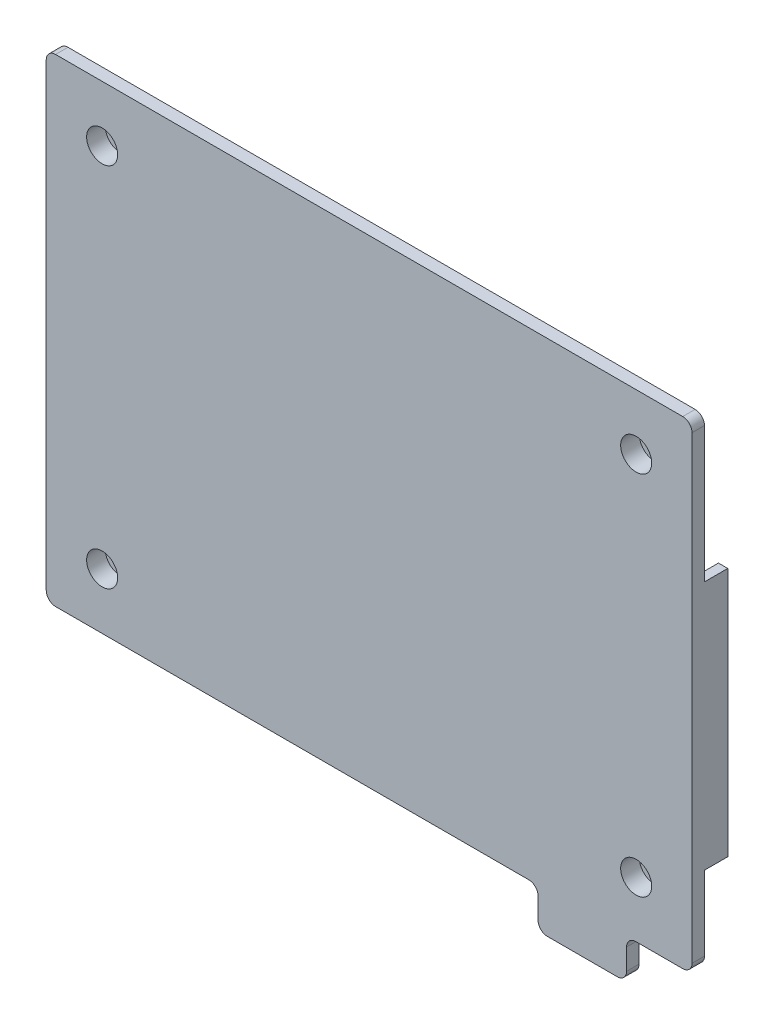
from build123d import *

# Parameters (mm, degrees)
BOTTOM_COVER_DEPTH    = 2
SKETCH5_W             = 1.5
SKETCH5_H             = 40.214188303
CONNECTOR_PANEL_DEPTH = 3.75
SKETCH6_W             = 68
SKETCH6_H             = 60
SKETCH6_W_2           = 64
SKETCH6_H_2           = 56
BATTERY_HOLDER_DEPTH  = 2
FILLET1_R             = 1.5
SKETCH7_R             = 3.5
BOSS_EXTRUDE4_DEPTH   = 3.9125
SKETCH8_R             = 1.25
CUT_EXTRUDE1_DEPTH    = 10
SKETCH9_R             = 2.5
CUT_EXTRUDE2_DEPTH    = 3


with BuildPart() as part:
    # Sketch1 → bottom-cover (new body)
    with BuildSketch(Plane.XY.offset(8.9125)):
        Polygon((102, -2), (102, 75), (-2, 75), (-2, -2), (77.2, -2), (77.2, -8.39995), (91.45, -8.39995), (91.45, -2), align=None)
    extrude(amount=BOTTOM_COVER_DEPTH)

    # Sketch5 → connector-panel (add)
    with BuildSketch(Plane(origin=(0, 0, 8.9125), x_dir=(-1, 0, 0), z_dir=(0, 0, -1))):
        with Locations((-101.25, 31.586987543)):
            Rectangle(SKETCH5_W, SKETCH5_H)
    extrude(amount=CONNECTOR_PANEL_DEPTH)

    # Sketch6 → battery-holder (add)
    with BuildSketch(Plane(origin=(0, 0, 8.9125), x_dir=(-1, 0, 0), z_dir=(0, 0, -1))):
        with Locations((-45.693698314, 36.057827653)):
            Rectangle(SKETCH6_W, SKETCH6_H)
        with Locations((-45.693698314, 36.057827653)):
            Rectangle(SKETCH6_W_2, SKETCH6_H_2, mode=Mode.SUBTRACT)
    extrude(amount=BATTERY_HOLDER_DEPTH)

    # Fillet1
    fillet1_edges = [part.edges().sort_by_distance(p)[0] for p in [
        (102, -2, 9.9125),
        (102, 75, 9.9125),
        (-2, 75, 9.9125),
        (91.45, -8.39995, 9.9125),
        (91.45, -2, 9.9125),
        (77.2, -2, 9.9125),
        (77.2, -8.39995, 9.9125),
        (-2, -2, 9.9125),
    ]]
    fillet(fillet1_edges, radius=FILLET1_R)

    # Sketch7 → Boss-Extrude4 (add)
    with BuildSketch(Plane(origin=(0, 0, 8.9125), x_dir=(-1, 0, 0), z_dir=(0, 0, -1))):
        with Locations(Location((-7, 66, 0), (0, 0, 180))):
            Circle(SKETCH7_R)
        with Locations(Location((-7, 7, 0), (0, 0, 180))):
            Circle(SKETCH7_R)
        with Locations(Location((-93, 7, 0), (0, 0, 180))):
            Circle(SKETCH7_R)
        with Locations(Location((-93, 66, 0), (0, 0, 180))):
            Circle(SKETCH7_R)
    extrude(amount=BOSS_EXTRUDE4_DEPTH)

    # Sketch8 → Cut-Extrude1 (cut)
    with BuildSketch(Plane(origin=(0, 0, 5), x_dir=(-1, 0, 0), z_dir=(0, 0, -1))):
        with Locations((-93, 66)):
            Circle(SKETCH8_R)
        with Locations((-7, 66)):
            Circle(SKETCH8_R)
        with Locations((-7, 7)):
            Circle(SKETCH8_R)
        with Locations((-93, 7)):
            Circle(SKETCH8_R)
    extrude(amount=-CUT_EXTRUDE1_DEPTH, mode=Mode.SUBTRACT)

    # Sketch9 → Cut-Extrude2 (cut)
    with BuildSketch(Plane.XY.offset(10.9125)):
        with Locations((7, 66)):
            Circle(SKETCH9_R)
        with Locations((93, 66)):
            Circle(SKETCH9_R)
        with Locations((93, 7)):
            Circle(SKETCH9_R)
        with Locations((7, 7)):
            Circle(SKETCH9_R)
    extrude(amount=-CUT_EXTRUDE2_DEPTH, mode=Mode.SUBTRACT)


solid = part.part
